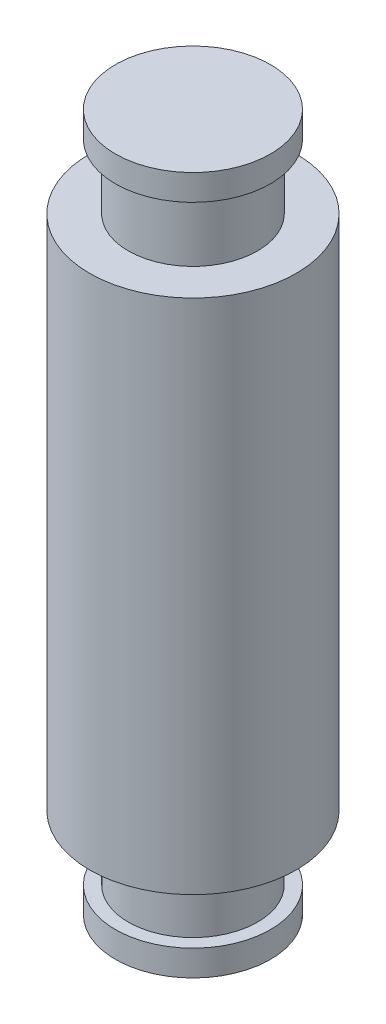
from build123d import *

# Parameters (mm, degrees)
SKETCH2_R           = 4
BOSS_EXTRUDE2_DEPTH = 20
SKETCH3_R           = 2.5
BOSS_EXTRUDE3_DEPTH = 2.5
SKETCH4_R           = 3
BOSS_EXTRUDE4_DEPTH = 1
BOSS_EXTRUDE5_START = 2.5
SKETCH5_R           = 2.5
BOSS_EXTRUDE5_DEPTH = 2.5
BOSS_EXTRUDE7_START = 1
SKETCH6_R           = 3
BOSS_EXTRUDE7_DEPTH = 1


with BuildPart() as part:
    # Sketch2 → Boss-Extrude2 (new body)
    with BuildSketch(Plane(origin=(0, 0, 0), x_dir=(1, 0, 0), z_dir=(0, 1, 0))):
        with Locations(Location((0, 0, 0), (0, 0, 270))):
            Circle(SKETCH2_R)
    extrude(amount=BOSS_EXTRUDE2_DEPTH)

    # Sketch3 → Boss-Extrude3 (add)
    with BuildSketch(Plane.XZ):
        with Locations(Location((0, 0, 0), (0, 0, 270))):
            Circle(SKETCH3_R)
    extrude(amount=BOSS_EXTRUDE3_DEPTH)

    # Sketch4 → Boss-Extrude4 (add)
    with BuildSketch(Plane.XZ.offset(2.5)):
        with Locations(Location((0, 0, 0), (0, 0, 270))):
            Circle(SKETCH4_R)
    extrude(amount=BOSS_EXTRUDE4_DEPTH)

    # Sketch5 → Boss-Extrude5 (add)
    with BuildSketch(Plane(origin=(0, 20, 0), x_dir=(1, 0, 0), z_dir=(0, 1, 0)).offset(BOSS_EXTRUDE5_START)):
        with Locations(Location((0, 0, 0), (0, 0, 90))):
            Circle(SKETCH5_R)
    extrude(amount=-BOSS_EXTRUDE5_DEPTH)

    # Sketch6 → Boss-Extrude7 (add)
    with BuildSketch(Plane(origin=(0, 22.5, 0), x_dir=(1, 0, 0), z_dir=(0, 1, 0)).offset(BOSS_EXTRUDE7_START)):
        with Locations(Location((0, 0, 0), (0, 0, 90))):
            Circle(SKETCH6_R)
    extrude(amount=-BOSS_EXTRUDE7_DEPTH)


solid = part.part
